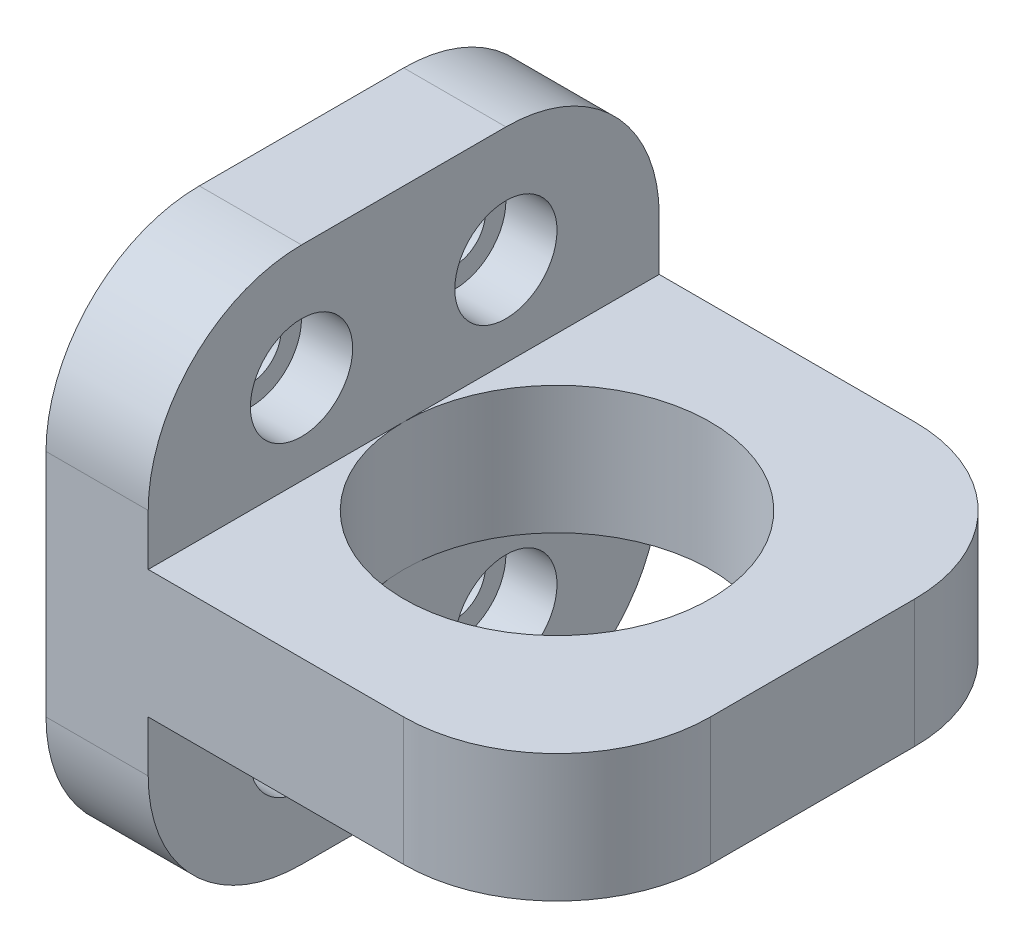
from build123d import *

# Parameters (mm, degrees)
SKETCH_1_W          = 10
SKETCH_1_H          = 10
SKETCH_1_R          = 3
EXTRUDE_1_DEPTH     = 2.5
SKETCH_3_W          = 10
SKETCH_3_H          = 10.5
EXTRUDE_2_DEPTH     = 2
SKETCH_3_3_R        = 0.6
CUT_EXTRUDE_1_DEPTH = 13.932517156
CUT_EXTRUDE_START   = -2
SKETCH_3_4_R        = 1
CUT_EXTRUDE_2_DEPTH = 1
FILLET_1_R          = 3
FILLET_2_R          = 3


with BuildPart() as part:
    # 草图1 → 凸台-拉伸1 (new body)
    with BuildSketch(Plane(origin=(0, 0, 0), x_dir=(1, 0, 0), z_dir=(0, 1, 0))):
        Rectangle(SKETCH_1_W, SKETCH_1_H)
        with Locations(Location((0, 0, 0), (0, 0, 270))):
            Circle(SKETCH_1_R, mode=Mode.SUBTRACT)
    extrude(amount=EXTRUDE_1_DEPTH)

    # 草图3 → 凸台-拉伸2 (add)
    with BuildSketch(Plane.ZY.offset(5)):
        with Locations((0, 1.25)):
            Rectangle(SKETCH_3_W, SKETCH_3_H)
    extrude(amount=-EXTRUDE_2_DEPTH)

    # 草图3<3> → 切除-拉伸1 (cut, through all)
    with BuildSketch(Plane.ZY.offset(5)):
        with Locations((-2, 4.25)):
            Circle(SKETCH_3_3_R)
        with Locations((2, 4.25)):
            Circle(SKETCH_3_3_R)
        with Locations((-2, -1.75)):
            Circle(SKETCH_3_3_R)
        with Locations((2, -1.75)):
            Circle(SKETCH_3_3_R)
    extrude(amount=-CUT_EXTRUDE_1_DEPTH, mode=Mode.SUBTRACT)

    # 草图3<4> → 切除-拉伸2 (cut)
    with BuildSketch(Plane.ZY.offset(5).offset(CUT_EXTRUDE_START)):
        with Locations(Location((-2, 4.25, 0), (0, 0, 180))):
            Circle(SKETCH_3_4_R)
        with Locations(Location((2, 4.25, 0), (0, 0, 180))):
            Circle(SKETCH_3_4_R)
        with Locations(Location((-2, -1.75, 0), (0, 0, 180))):
            Circle(SKETCH_3_4_R)
        with Locations(Location((2, -1.75, 0), (0, 0, 180))):
            Circle(SKETCH_3_4_R)
    extrude(amount=CUT_EXTRUDE_2_DEPTH, mode=Mode.SUBTRACT)

    # 圆角1
    fillet_1_edges = [part.edges().sort_by_distance(p)[0] for p in [
        (5, 1.25, 5),
        (5, 1.25, -5),
    ]]
    fillet(fillet_1_edges, radius=FILLET_1_R)

    # 圆角2
    fillet_2_edges = [part.edges().sort_by_distance(p)[0] for p in [
        (-4, 6.5, 5),
        (-4, 6.5, -5),
        (-4, -4, 5),
        (-4, -4, -5),
    ]]
    fillet(fillet_2_edges, radius=FILLET_2_R)


solid = part.part
